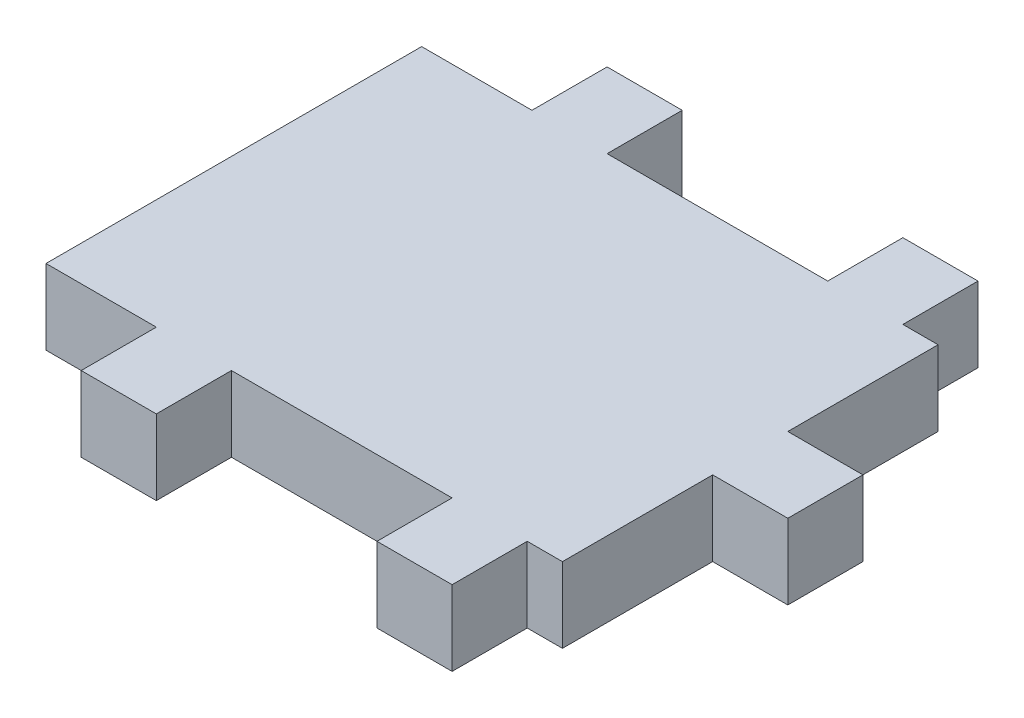
from build123d import *

# Parameters (mm, degrees)
SKETCH3_W           = 87.3
SKETCH3_H           = 63.5
BOSS_EXTRUDE3_DEPTH = 12.7
SKETCH4_W           = 12.7
SKETCH4_H           = 12.7
BOSS_EXTRUDE4_DEPTH = 12.7
SKETCH5_W           = 12.7
SKETCH5_H           = 12.7
BOSS_EXTRUDE7_DEPTH = 12.7


with BuildPart() as part:
    # Sketch3 → Boss-Extrude3 (new body)
    with BuildSketch(Plane(origin=(0, 0, 0), x_dir=(1, 0, 0), z_dir=(0, 1, 0))):
        Rectangle(SKETCH3_W, SKETCH3_H)
    extrude(amount=BOSS_EXTRUDE3_DEPTH)

    # Sketch4 → Boss-Extrude4 (add)
    with BuildSketch(Plane(origin=(43.65, 0, 0), x_dir=(0, 0, -1), z_dir=(1, 0, 0))):
        with Locations((0, 6.35)):
            Rectangle(SKETCH4_W, SKETCH4_H)
    extrude(amount=BOSS_EXTRUDE4_DEPTH)

    # Sketch5 → Boss-Extrude7 (add)
    with BuildSketch(Plane.XY.offset(31.75)):
        Polygon((-12.300000038, 12.7), (-25.000000038, 12.7), (-25.000000038, 6.35), (-25.000000038, 0), (-12.300000038, 0), align=None)
        with Locations((31.349999962, 6.35)):
            Rectangle(SKETCH5_W, SKETCH5_H)
    boss_extrude7 = extrude(amount=BOSS_EXTRUDE7_DEPTH)

    # Mirror2: Boss-Extrude7 across plane
    add(boss_extrude7.mirror(Plane.XY))


solid = part.part
